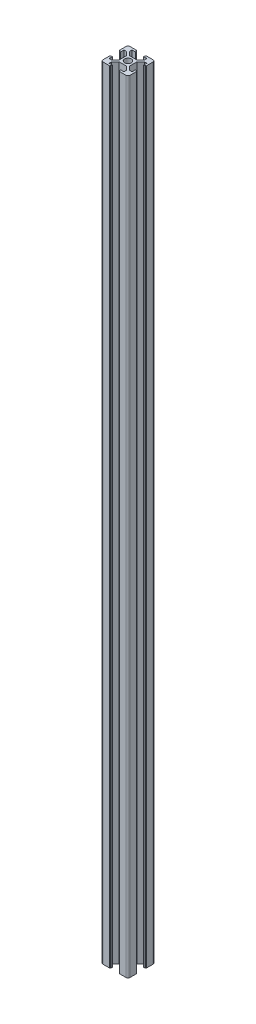
from build123d import *

# Parameters (mm, degrees)
SKETCH_2_R      = 2.5
EXTRUDE_1_DEPTH = 580


with BuildPart() as part:
    # 草图2 → 凸台-拉伸1 (new body)
    with BuildSketch(Plane(origin=(0, 0, 0), x_dir=(1, 0, 0), z_dir=(0, 1, 0))):
        with BuildLine():
            Line((-3.6, 10), (-3.6, 9.5))
            Line((-3.6, 9.5), (-3.1, 9.5))
            Line((-3.1, 9.5), (-3.1, 8.5))
            Line((-3.1, 8.5), (-5.5, 8.5))
            Line((-5.5, 8.5), (-5.5, 6.65))
            Line((-5.5, 6.65), (-2.75, 3.9))
            Line((-2.75, 3.9), (2.75, 3.9))
            Line((2.75, 3.9), (5.5, 6.65))
            Line((5.5, 6.65), (5.5, 8.5))
            Line((5.5, 8.5), (3.1, 8.5))
            Line((3.1, 8.5), (3.1, 9.5))
            Line((3.1, 9.5), (3.6, 9.5))
            Line((3.6, 9.5), (3.6, 10))
            Line((3.6, 10), (8.5, 10))
            ThreePointArc((8.5, 10), (9.560660172, 9.560660172), (10, 8.5))
            Line((10, 8.5), (10, 3.6))
            Line((10, 3.6), (9.5, 3.6))
            Line((9.5, 3.6), (9.5, 3.1))
            Line((9.5, 3.1), (8.5, 3.1))
            Line((8.5, 3.1), (8.5, 5.5))
            Line((8.5, 5.5), (6.65, 5.5))
            Line((6.65, 5.5), (3.9, 2.75))
            Line((3.9, 2.75), (3.9, -2.75))
            Line((3.9, -2.75), (6.65, -5.5))
            Line((6.65, -5.5), (8.5, -5.5))
            Line((8.5, -5.5), (8.5, -3.1))
            Line((8.5, -3.1), (9.5, -3.1))
            Line((9.5, -3.1), (9.5, -3.6))
            Line((9.5, -3.6), (10, -3.6))
            Line((10, -3.6), (10, -8.5))
            ThreePointArc((10, -8.5), (9.560660172, -9.560660172), (8.5, -10))
            Line((8.5, -10), (3.6, -10))
            Line((3.6, -10), (3.6, -9.5))
            Line((3.6, -9.5), (3.1, -9.5))
            Line((3.1, -9.5), (3.1, -8.5))
            Line((3.1, -8.5), (5.5, -8.5))
            Line((5.5, -8.5), (5.5, -6.65))
            Line((5.5, -6.65), (2.75, -3.9))
            Line((2.75, -3.9), (-2.75, -3.9))
            Line((-2.75, -3.9), (-5.5, -6.65))
            Line((-5.5, -6.65), (-5.5, -8.5))
            Line((-5.5, -8.5), (-3.1, -8.5))
            Line((-3.1, -8.5), (-3.1, -9.5))
            Line((-3.1, -9.5), (-3.6, -9.5))
            Line((-3.6, -9.5), (-3.6, -10))
            Line((-3.6, -10), (-8.5, -10))
            ThreePointArc((-8.5, -10), (-9.560660172, -9.560660172), (-10, -8.5))
            Line((-10, -8.5), (-10, -3.6))
            Line((-10, -3.6), (-9.5, -3.6))
            Line((-9.5, -3.6), (-9.5, -3.1))
            Line((-9.5, -3.1), (-8.5, -3.1))
            Line((-8.5, -3.1), (-8.5, -5.5))
            Line((-8.5, -5.5), (-6.65, -5.5))
            Line((-6.65, -5.5), (-3.9, -2.75))
            Line((-3.9, -2.75), (-3.9, 2.75))
            Line((-3.9, 2.75), (-6.65, 5.5))
            Line((-6.65, 5.5), (-8.5, 5.5))
            Line((-8.5, 5.5), (-8.5, 3.1))
            Line((-8.5, 3.1), (-9.5, 3.1))
            Line((-9.5, 3.1), (-9.5, 3.6))
            Line((-9.5, 3.6), (-10, 3.6))
            Line((-10, 3.6), (-10, 8.5))
            ThreePointArc((-10, 8.5), (-9.560660172, 9.560660172), (-8.5, 10))
            Line((-8.5, 10), (-3.6, 10))
        make_face()
        with Locations(Location((0, 0, 0), (0, 0, 270))):
            Circle(SKETCH_2_R, mode=Mode.SUBTRACT)
    extrude(amount=EXTRUDE_1_DEPTH)


solid = part.part
